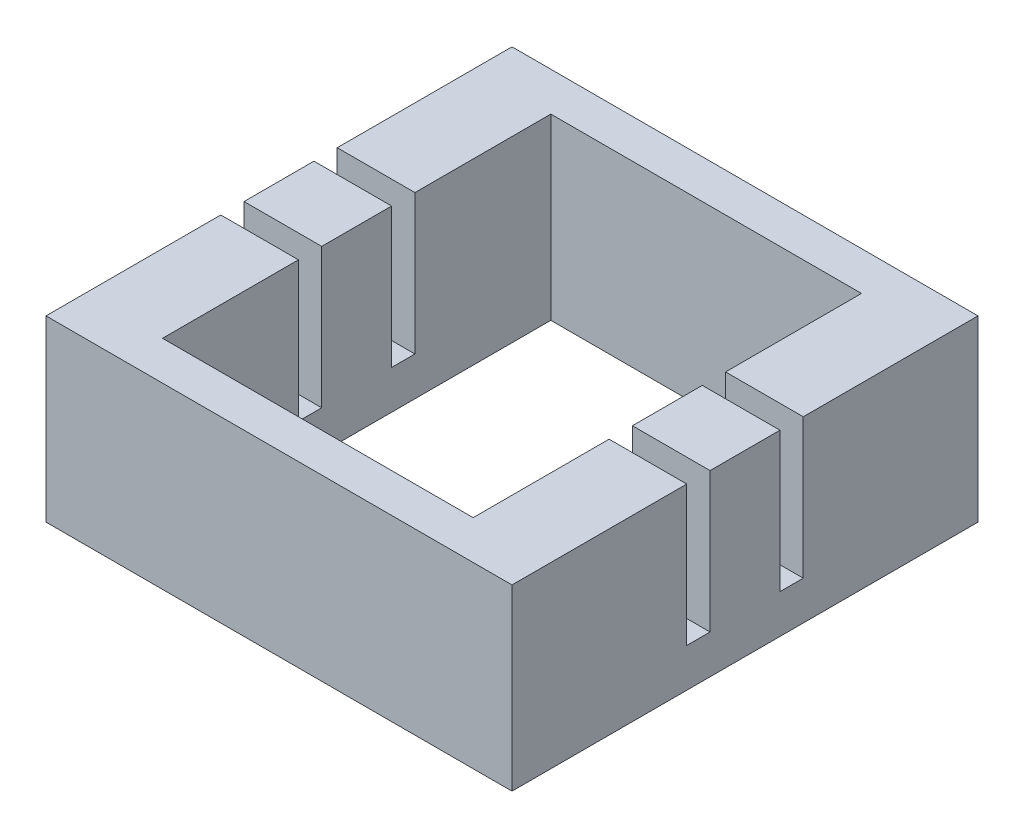
from build123d import *

# Parameters (mm, degrees)
SKETCH2_W           = 60
SKETCH2_H           = 60
SKETCH2_W_2         = 40
SKETCH2_H_2         = 50
BOSS_EXTRUDE2_DEPTH = 23
SKETCH3_W           = 3
SKETCH3_H           = 18
CUT_EXTRUDE1_DEPTH  = 88.914731416


with BuildPart() as part:
    # Sketch2 → Boss-Extrude2 (new body)
    with BuildSketch(Plane(origin=(0, 0, 0), x_dir=(1, 0, 0), z_dir=(0, 1, 0))):
        with Locations((30, 30)):
            Rectangle(SKETCH2_W, SKETCH2_H)
        with Locations((30, 30)):
            Rectangle(SKETCH2_W_2, SKETCH2_H_2, mode=Mode.SUBTRACT)
    extrude(amount=BOSS_EXTRUDE2_DEPTH)

    # Sketch3 → Cut-Extrude1 (cut, through all)
    with BuildSketch(Plane.ZY):
        with Locations((-36, 14)):
            Rectangle(SKETCH3_W, SKETCH3_H)
        with Locations((-24, 14)):
            Rectangle(SKETCH3_W, SKETCH3_H)
    extrude(amount=-CUT_EXTRUDE1_DEPTH, mode=Mode.SUBTRACT)


solid = part.part
